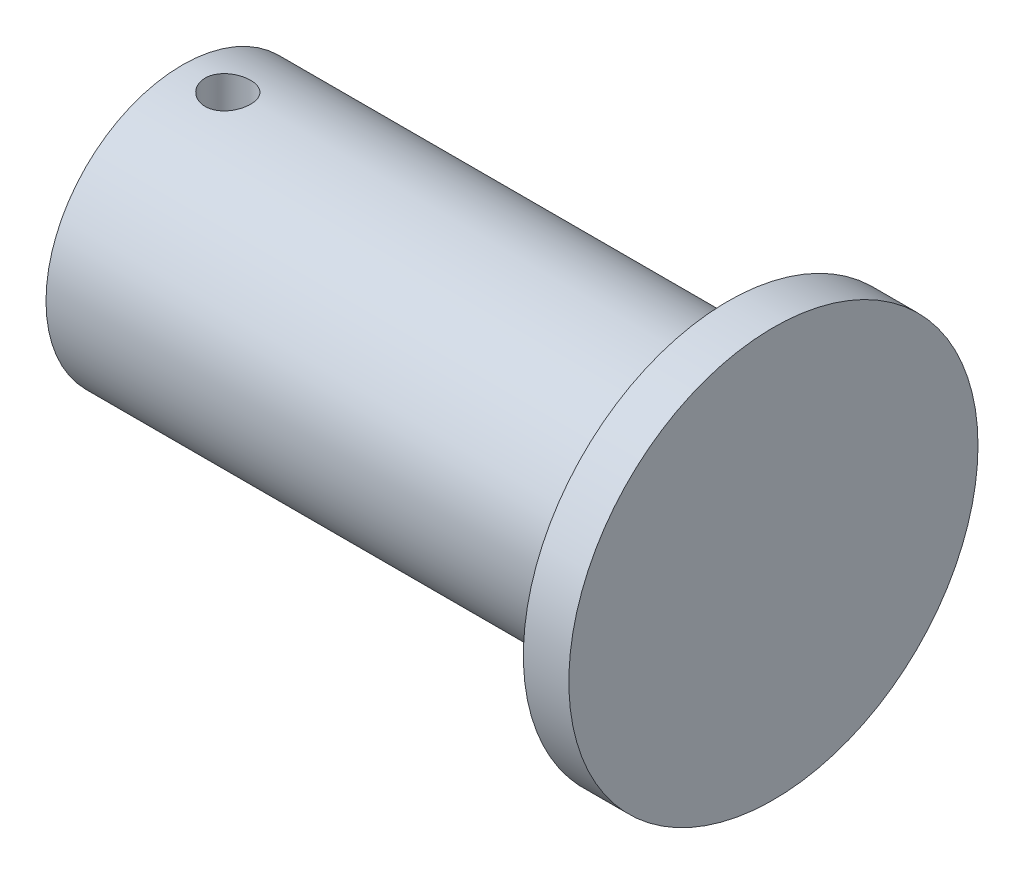
from build123d import *

# Parameters (mm, degrees)
SKETCH1_R               = 15
BOSS_EXTRUDE1_DEPTH     = 30
SKETCH2_R               = 22.5
BOSS_EXTRUDE2_DEPTH     = 5
CUT_EXTRUDE1_DEPTH      = 48.302219821
CUT_EXTRUDE1_DEPTH_BACK = 48.302219821
SKETCH3_R               = 2.5


with BuildPart() as part:
    # Sketch1 → Boss-Extrude1 (new, symmetric)
    with BuildSketch(Plane(origin=(0, 0, 0), x_dir=(0, 0, -1), z_dir=(1, 0, 0))):
        Circle(SKETCH1_R)
    extrude(amount=BOSS_EXTRUDE1_DEPTH, both=True)

    # Sketch2 → Boss-Extrude2 (add)
    with BuildSketch(Plane(origin=(30, 0, 0), x_dir=(0, 0, -1), z_dir=(1, 0, 0))):
        Circle(SKETCH2_R)
    extrude(amount=BOSS_EXTRUDE2_DEPTH)

    # Sketch3 → Cut-Extrude1 (cut, two sides: drawn at the far end of the back side and taken through both)
    with BuildSketch(Plane(origin=(0, 0, 0), x_dir=(1, 0, 0), z_dir=(0, 1, 0)).offset(-CUT_EXTRUDE1_DEPTH_BACK)):
        with Locations(Location((-25, 0, 0), (0, 0, 270))):
            Circle(SKETCH3_R)
    extrude(amount=CUT_EXTRUDE1_DEPTH + CUT_EXTRUDE1_DEPTH_BACK, mode=Mode.SUBTRACT)


solid = part.part
